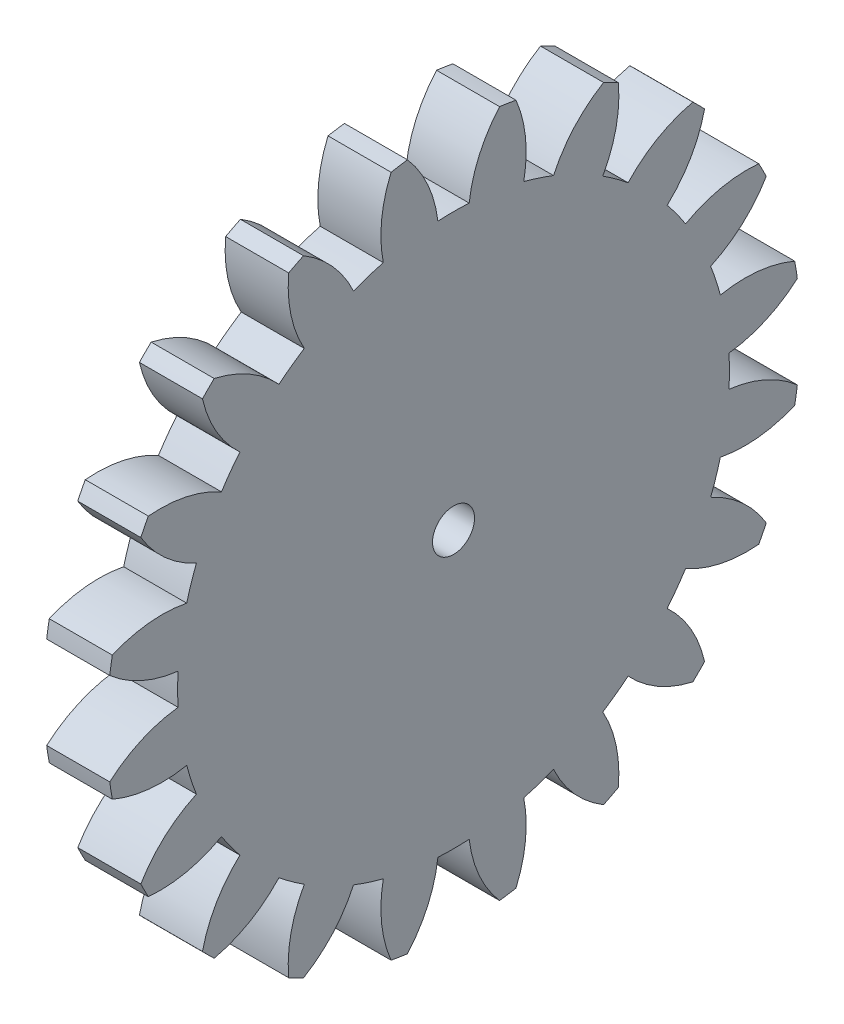
from build123d import *

# Parameters (mm, degrees)
BASPROSKE_W     = 6
BASPROSKE_H     = 33
TOOTHCUT_DEPTH  = 48.053161424
TEETHCUTS_COUNT = 20
TEETHCUTS_ANGLE = 342
BORSKE_R        = 2
BORE_DEPTH      = 50.0000508


with BuildPart() as part:
    # BasProSke → Base-Revolve (revolve)
    with BuildSketch(Plane(origin=(0, 0, 0), x_dir=(1, 0, 0), z_dir=(0, 1, 0)), mode=Mode.PRIVATE) as base_revolve_sk:
        with Locations((3, 16.5)):
            Rectangle(BASPROSKE_W, BASPROSKE_H)
    revolve(base_revolve_sk.sketch.rotate(Axis((-10, 0, 0), (1, 0, 0)), 180), axis=Axis((-10, 0, 0), (1, 0, 0)))

    # TooCutSke → ToothCut (cut, through all)
    with BuildSketch(Plane(origin=(0, 0, 0), x_dir=(0, 0, -1), z_dir=(1, 0, 0))):
        with BuildLine():
            ThreePointArc((1.489278925, 26.206717637), (0, 26.249), (-1.489278925, 26.206717637))
            ThreePointArc((-1.489278925, 26.206717637), (-2.448651415, 29.690511169), (-4.401620335, 32.730762038))
            ThreePointArc((-4.401620335, 32.730762038), (0, 33.0254), (4.401620335, 32.730762038))
            ThreePointArc((4.401620335, 32.730762038), (2.448651415, 29.690511169), (1.489278925, 26.206717637))
        make_face()
    toothcut = extrude(amount=TOOTHCUT_DEPTH, mode=Mode.SUBTRACT)

    # TeethCuts: ToothCut ×20 about axis
    teethcuts_axis = Axis((-10, 0, 0), (1, 0, 0))
    for i in range(1, TEETHCUTS_COUNT):
        add(toothcut.rotate(teethcuts_axis, i * TEETHCUTS_ANGLE / (TEETHCUTS_COUNT - 1)), mode=Mode.SUBTRACT)

    # BorSke → Bore (cut, symmetric)
    with BuildSketch(Plane(origin=(0, 0, 0), x_dir=(0, 0, -1), z_dir=(1, 0, 0))):
        with Locations(Location((0, 0, 0), (0, 0, 180))):
            Circle(BORSKE_R)
    extrude(amount=BORE_DEPTH, both=True, mode=Mode.SUBTRACT)


solid = part.part
